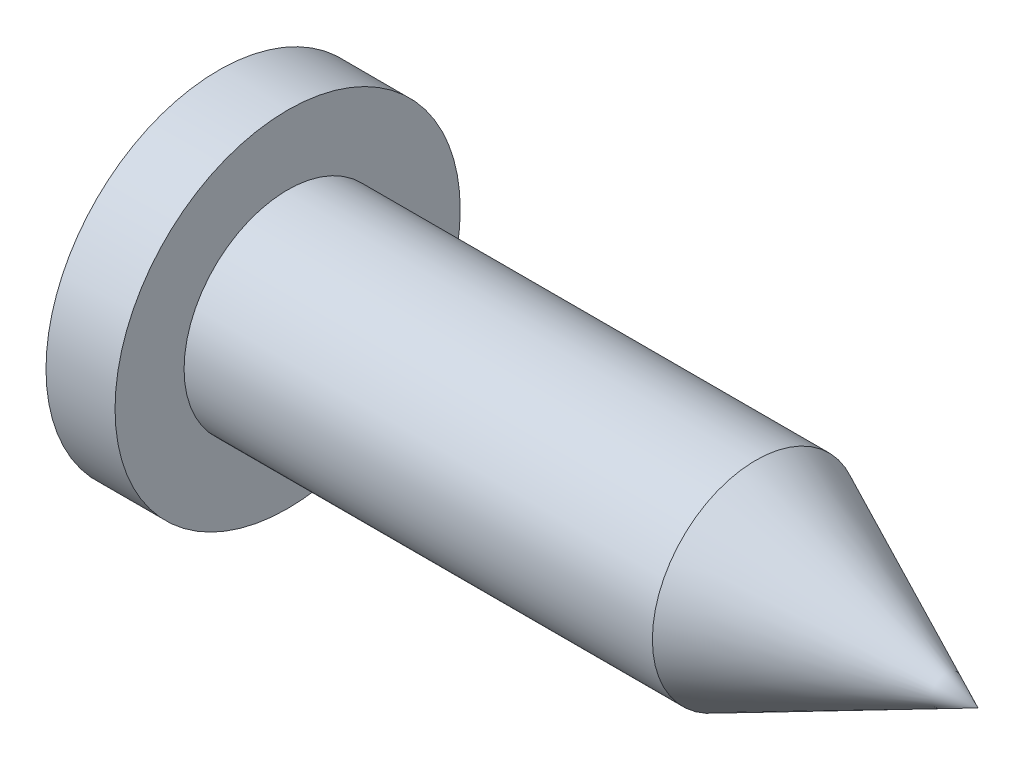
from build123d import *

# Parameters (mm, degrees)
CUT_EXTRUDE_1_DEPTH = 0.5


with BuildPart() as part:
    # 草图1 → 旋转1 (revolve)
    with BuildSketch(Plane.XY, mode=Mode.PRIVATE) as revolve_1_sk:
        with BuildLine():
            Line((1.5, 2.5), (1.5, 1.5))
            Line((1.5, 1.5), (8.283239619, 1.5))
            Line((8.283239619, 1.5), (11.5, 0))
            Line((11.5, 0), (0, 0))
            ThreePointArc((0, 0), (0.126225608, 1.274754878), (0.5, 2.5))
            Line((0.5, 2.5), (1.5, 2.5))
        make_face()
    revolve(revolve_1_sk.sketch.rotate(Axis((-93.852509653, 0, 0), (1, 0, 0)), 90), axis=Axis((-93.852509653, 0, 0), (1, 0, 0)))

    # 草图2 → 切除-拉伸1 (cut)
    with BuildSketch(Plane(origin=(0, 0, 0), x_dir=(0, 0, -1), z_dir=(1, 0, 0))):
        with BuildLine():
            Line((1.5, 0.25), (1.05, 0.25))
            ThreePointArc((1.05, 0.25), (0.484314575, 0.484314575), (0.25, 1.05))
            Line((0.25, 1.05), (0.25, 1.5))
            Line((0.25, 1.5), (-0.25, 1.5))
            Line((-0.25, 1.5), (-0.25, 1.05))
            ThreePointArc((-0.25, 1.05), (-0.484314575, 0.484314575), (-1.05, 0.25))
            Line((-1.05, 0.25), (-1.5, 0.25))
            Line((-1.5, 0.25), (-1.5, -0.25))
            Line((-1.5, -0.25), (-1.05, -0.25))
            ThreePointArc((-1.05, -0.25), (-0.484314575, -0.484314575), (-0.25, -1.05))
            Line((-0.25, -1.05), (-0.25, -1.5))
            Line((-0.25, -1.5), (0.25, -1.5))
            Line((0.25, -1.5), (0.25, -1.05))
            ThreePointArc((0.25, -1.05), (0.484314575, -0.484314575), (1.05, -0.25))
            Line((1.05, -0.25), (1.5, -0.25))
            Line((1.5, -0.25), (1.5, 0.25))
        make_face()
    extrude(amount=CUT_EXTRUDE_1_DEPTH, mode=Mode.SUBTRACT)


solid = part.part
